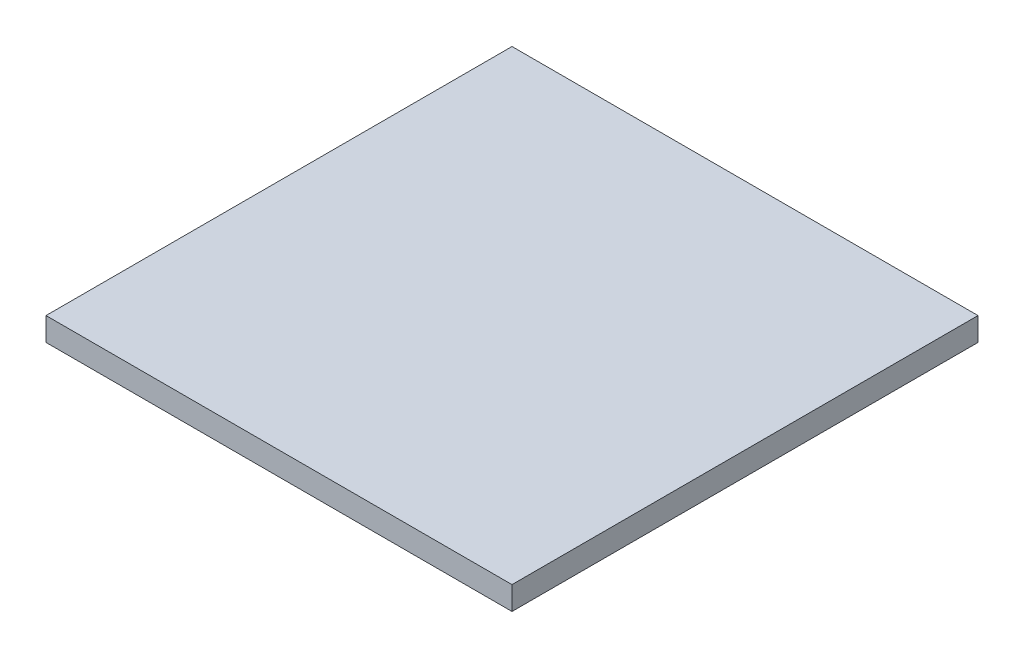
from build123d import *

# Parameters (mm, degrees)
CROQUIS1_W              = 10
CROQUIS1_H              = 10
SALIENTE_EXTRUIR1_DEPTH = 0.5


with BuildPart() as part:
    # Croquis1 → Saliente-Extruir1 (new body)
    with BuildSketch(Plane(origin=(0, 0, 0), x_dir=(1, 0, 0), z_dir=(0, 1, 0))):
        with Locations((5, 5)):
            Rectangle(CROQUIS1_W, CROQUIS1_H)
    extrude(amount=SALIENTE_EXTRUIR1_DEPTH)


solid = part.part
